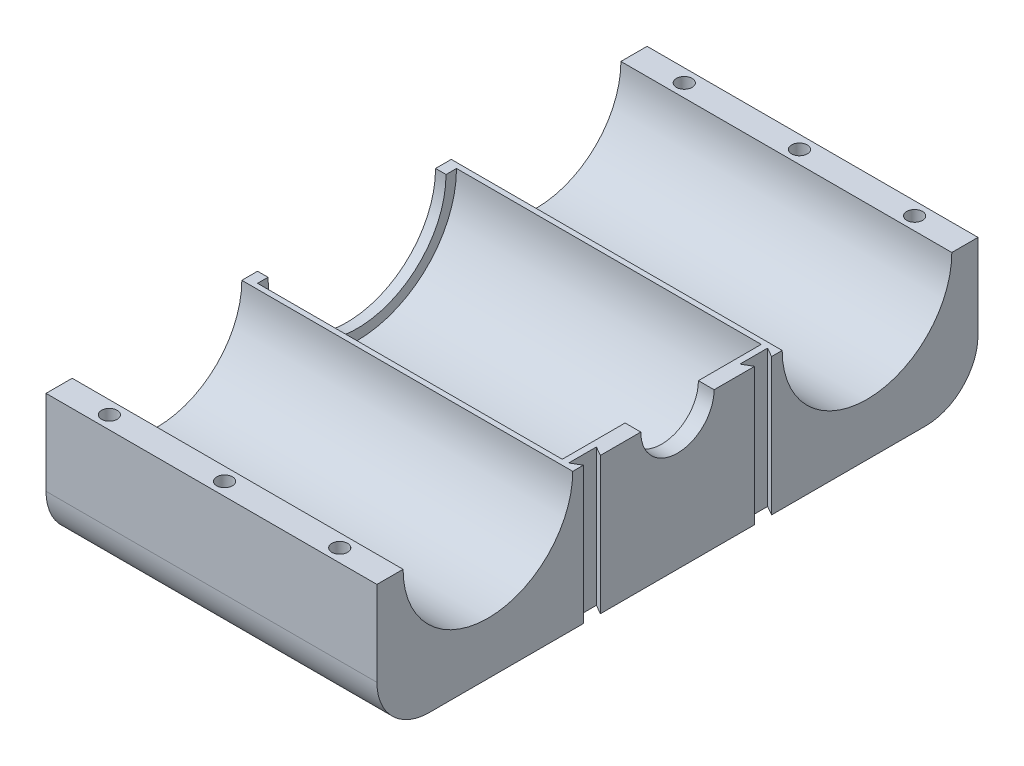
from build123d import *

# Parameters (mm, degrees)
BOSS_EXTRUDE1_DEPTH = 63.2
CUT_EXTRUDE14_REACH = 135.64
SKETCH31_R          = 19
CUT_EXTRUDE15_DEPTH = 60.2
CUT_EXTRUDE16_REACH = 135.64
SKETCH32_R          = 7
BOSS_EXTRUDE6_DEPTH = 2
FILLET1_R           = 10
SKETCH34_R          = 1.5
CUT_EXTRUDE17_DEPTH = 15


with BuildPart() as part:
    # Sketch1 → Boss-Extrude1 (new body)
    with BuildSketch(Plane(origin=(0, 0, 0), x_dir=(0, 0, -1), z_dir=(1, 0, 0))):
        with BuildLine():
            Line((0, 0), (114.8, 0))
            Line((114.8, 0), (114.8, 26.2))
            Line((114.8, 26.2), (109.8, 26.2))
            ThreePointArc((109.8, 26.2), (93.6, 10), (77.4, 26.2))
            Line((77.4, 26.2), (37.4, 26.2))
            ThreePointArc((37.4, 26.2), (21.2, 10), (5, 26.2))
            Line((5, 26.2), (0, 26.2))
            Line((0, 26.2), (0, 0))
        make_face()
    extrude(amount=BOSS_EXTRUDE1_DEPTH)

    # Sketch30 → Cut-Extrude14 (cut, up to next)
    with BuildSketch(Plane(origin=(0, 26.2, 0), x_dir=(1, 0, 0), z_dir=(0, 1, 0)), mode=Mode.PRIVATE) as cut_extrude14_sk1:
        Polygon((63.2, 75.375), (61.424647922, 76.4), (61.424647922, 71.1), (63.2, 72.125), align=None)
    cut_extrude14_tool1 = extrude(cut_extrude14_sk1.sketch, amount=-CUT_EXTRUDE14_REACH, mode=Mode.PRIVATE) & part.part
    # Sketch30 → Cut-Extrude14 (cut, up to next)
    with BuildSketch(Plane(origin=(0, 26.2, 0), x_dir=(1, 0, 0), z_dir=(0, 1, 0)), mode=Mode.PRIVATE) as cut_extrude14_sk2:
        Polygon((63.2, 42.675), (61.424647922, 43.7), (61.424647922, 38.4), (63.2, 39.425), align=None)
    cut_extrude14_tool2 = extrude(cut_extrude14_sk2.sketch, amount=-CUT_EXTRUDE14_REACH, mode=Mode.PRIVATE) & part.part
    add(cut_extrude14_tool1.solids().sort_by_distance((62.241379, 26.2, -73.75))[0], mode=Mode.SUBTRACT)
    add(cut_extrude14_tool2.solids().sort_by_distance((62.241379, 26.2, -41.05))[0], mode=Mode.SUBTRACT)

    # Sketch31 → Cut-Extrude15 (cut)
    with BuildSketch(Plane.ZY):
        with Locations((-57.4, 26.2)):
            Circle(SKETCH31_R)
    extrude(amount=-CUT_EXTRUDE15_DEPTH, mode=Mode.SUBTRACT)

    # Sketch32 → Cut-Extrude16 (cut, up to next)
    with BuildSketch(Plane(origin=(63.2, 0, 0), x_dir=(0, 0, -1), z_dir=(1, 0, 0)), mode=Mode.PRIVATE) as cut_extrude16_sk1:
        with Locations((57.4, 26.2)):
            Circle(SKETCH32_R)
    cut_extrude16_tool1 = extrude(cut_extrude16_sk1.sketch, amount=-CUT_EXTRUDE16_REACH, mode=Mode.PRIVATE) & part.part
    add(cut_extrude16_tool1.solids().sort_by_distance((63.2, 26.2, -57.4))[0], mode=Mode.SUBTRACT)

    # Sketch33 → Boss-Extrude6 (add)
    with BuildSketch(Plane.ZY):
        with BuildLine():
            Line((-74.4, 26.2), (-76.4, 26.2))
            ThreePointArc((-76.4, 26.2), (-57.4, 7.2), (-38.4, 26.2))
            Line((-38.4, 26.2), (-40.4, 26.2))
            ThreePointArc((-40.4, 26.2), (-57.4, 9.2), (-74.4, 26.2))
        make_face()
    extrude(amount=-BOSS_EXTRUDE6_DEPTH)

    # Fillet1
    fillet1_edges = [part.edges().sort_by_distance(p)[0] for p in [
        (31.6, 0, -114.8),
        (31.6, 0, 0),
    ]]
    fillet(fillet1_edges, radius=FILLET1_R)

    # Sketch34 → Cut-Extrude17 (cut)
    with BuildSketch(Plane(origin=(0, 26.2, 0), x_dir=(1, 0, 0), z_dir=(0, 1, 0))):
        with Locations(Location((9.6, 112.3, 0), (0, 0, 270))):
            Circle(SKETCH34_R)
        with Locations(Location((31.6, 112.3, 0), (0, 0, 270))):
            Circle(SKETCH34_R)
        with Locations(Location((53.6, 112.3, 0), (0, 0, 270))):
            Circle(SKETCH34_R)
        with Locations(Location((53.6, 2.5, 0), (0, 0, 90))):
            Circle(SKETCH34_R)
        with Locations(Location((31.6, 2.5, 0), (0, 0, 90))):
            Circle(SKETCH34_R)
        with Locations(Location((9.6, 2.5, 0), (0, 0, 90))):
            Circle(SKETCH34_R)
    extrude(amount=-CUT_EXTRUDE17_DEPTH, mode=Mode.SUBTRACT)


solid = part.part
